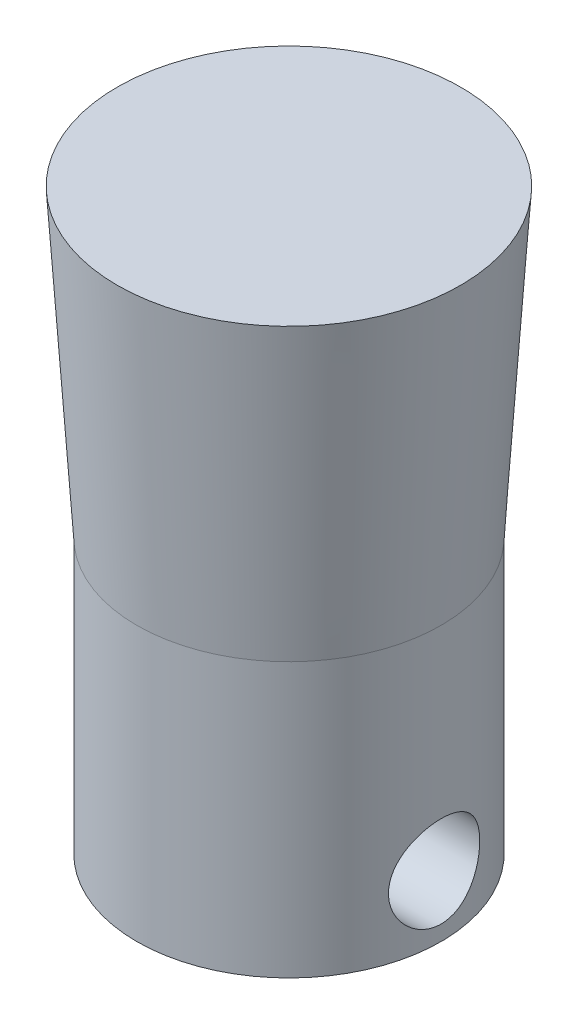
from build123d import *

# Parameters (mm, degrees)
SKETCH1_R             = 5
BODY_DEPTH            = 9
PIN_INSERT_DEPTH      = 12.445523142
PIN_INSERT_DEPTH_BACK = 12.445523142
SKETCH2_R             = 1.5
HEAD_SA_R             = 5.642


with BuildPart() as part:
    # Sketch1 → body (new body)
    with BuildSketch(Plane(origin=(0, 0, 0), x_dir=(1, 0, 0), z_dir=(0, 1, 0))):
        with Locations(Location((0, 0, 0), (0, 0, 270))):
            Circle(SKETCH1_R)
    extrude(amount=BODY_DEPTH)

    # Sketch2 → pin insert (cut, two sides: drawn at the far end of the back side and taken through both)
    with BuildSketch(Plane(origin=(0, 0, 0), x_dir=(0, 0, -1), z_dir=(1, 0, 0)).offset(-PIN_INSERT_DEPTH_BACK)):
        with Locations((0, 2)):
            Circle(SKETCH2_R)
    extrude(amount=PIN_INSERT_DEPTH + PIN_INSERT_DEPTH_BACK, mode=Mode.SUBTRACT)

    # head SA → section 0 of cone
    with BuildSketch(Plane(origin=(0, 19, 0), x_dir=(1, 0, 0), z_dir=(0, 1, 0)), mode=Mode.PRIVATE) as cone_s0:
        Circle(HEAD_SA_R)
    # loft up to a face of the part (cone)
    loft([cone_s0.sketch, part.faces().sort_by_distance((0, 9, 0))[0]])


solid = part.part
